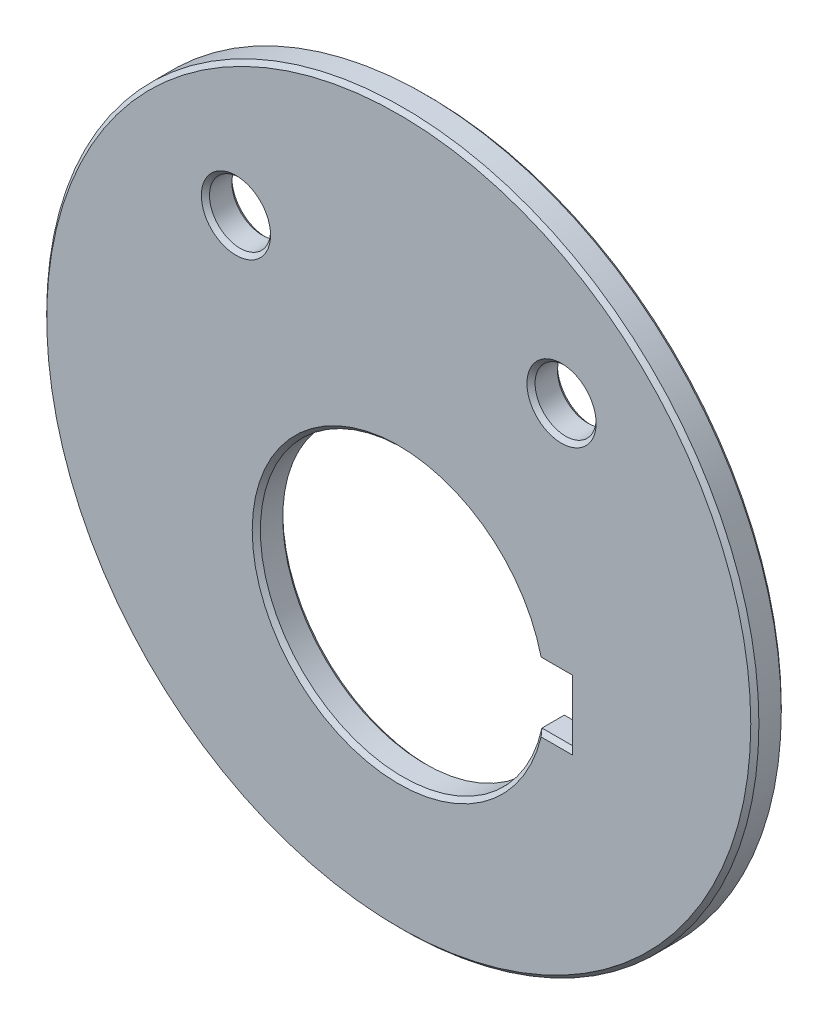
from build123d import *

# Parameters (mm, degrees)
SKETCH1_R           = 17.5
SKETCH1_R_2         = 1.5
BOSS_EXTRUDE1_DEPTH = 1.5
CHAMFER1_SIZE       = 0.2


with BuildPart() as part:
    # Sketch1 → Boss-Extrude1 (new body)
    with BuildSketch(Plane.XY):
        Circle(SKETCH1_R)
        with Locations((-8, 9)):
            Circle(SKETCH1_R_2, mode=Mode.SUBTRACT)
        with Locations((8, 9)):
            Circle(SKETCH1_R_2, mode=Mode.SUBTRACT)
        with BuildLine():
            Line((8.337397166, -2.5), (6.837397166, -2.5))
            ThreePointArc((6.837397166, -2.5), (-7, -4), (6.837397166, -5.5))
            Line((6.837397166, -5.5), (8.337397166, -5.5))
            Line((8.337397166, -5.5), (8.337397166, -2.5))
        make_face(mode=Mode.SUBTRACT)
    extrude(amount=BOSS_EXTRUDE1_DEPTH)

    # Chamfer1
    chamfer1_edges = [part.edges().sort_by_distance(p)[0] for p in [
        (-7, -4, 1.5),
        (7.587397166, -5.5, 1.5),
        (6.5, 9, 0),
        (6.5, 9, 1.5),
        (-17.5, 0, 0),
        (-9.5, 9, 0),
        (-9.5, 9, 1.5),
        (-17.5, 0, 1.5),
        (8.337397166, -4, 0),
        (7.587397166, -2.5, 0),
        (-7, -4, 0),
        (7.587397166, -5.5, 0),
        (8.337397166, -4, 1.5),
        (7.587397166, -2.5, 1.5),
    ]]
    chamfer(chamfer1_edges, length=CHAMFER1_SIZE)


solid = part.part
